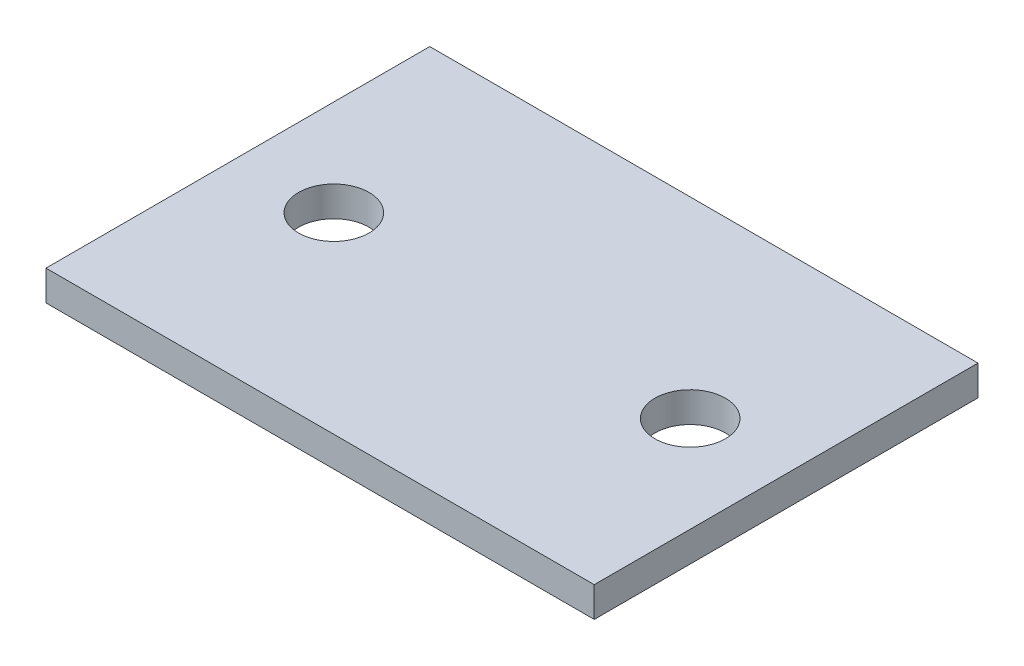
from build123d import *

# Parameters (mm, degrees)
SKETCH2_W           = 50.8
SKETCH2_H           = 35.56
SKETCH2_R           = 3.2639
BOSS_EXTRUDE1_DEPTH = 2.794


with BuildPart() as part:
    # Sketch2 → Boss-Extrude1 (new body)
    with BuildSketch(Plane(origin=(0, 0, 0), x_dir=(1, 0, 0), z_dir=(0, 1, 0))):
        Rectangle(SKETCH2_W, SKETCH2_H)
        with Locations(Location((-16.51, 0, 0), (0, 0, 270))):
            Circle(SKETCH2_R, mode=Mode.SUBTRACT)
        with Locations(Location((16.51, 0, 0), (0, 0, 90))):
            Circle(SKETCH2_R, mode=Mode.SUBTRACT)
    extrude(amount=BOSS_EXTRUDE1_DEPTH)


solid = part.part
